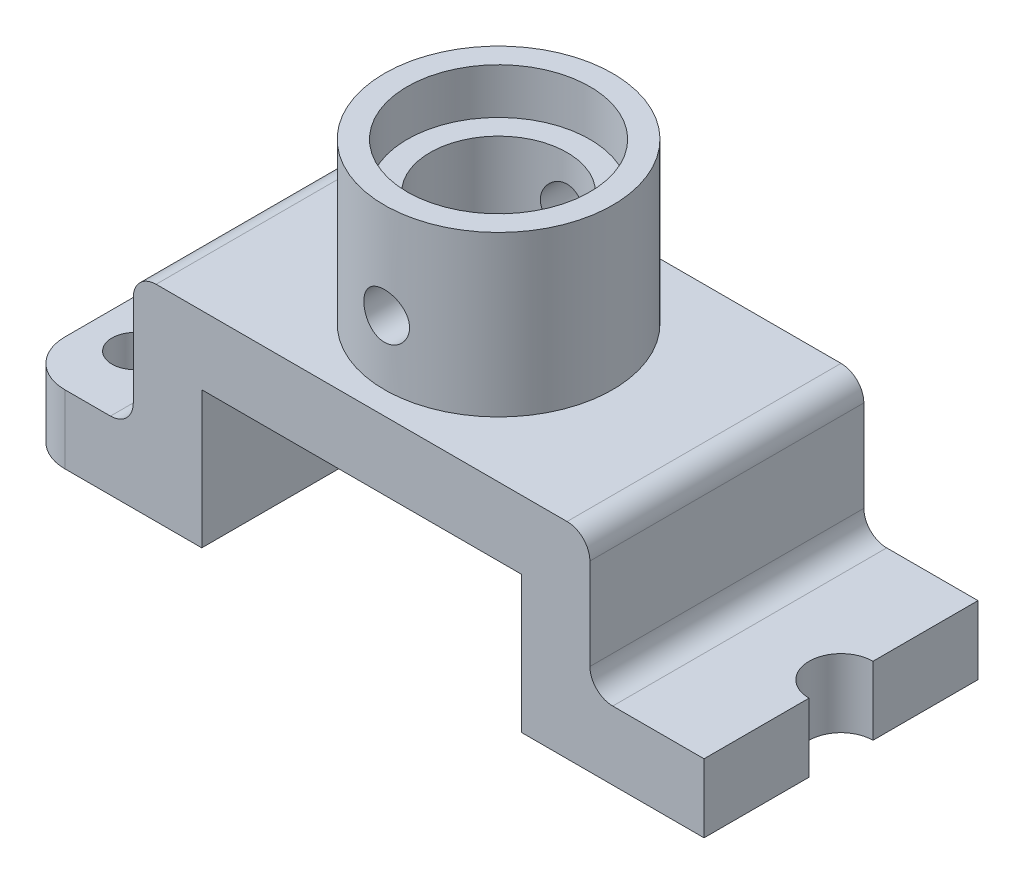
from build123d import *

# Parameters (mm, degrees)
SKETCH1_W           = 150
SKETCH1_H           = 45
BOSS_EXTRUDE1_DEPTH = 60
SKETCH2_W           = 70
SKETCH2_H           = 30
CUT_EXTRUDE1_DEPTH  = 60
SKETCH8_W           = 25
SKETCH8_H           = 60
CUT_EXTRUDE5_DEPTH  = 30
SKETCH9_R           = 25
BOSS_EXTRUDE4_DEPTH = 35
SKETCH10_R          = 20
SKETCH10_R_2        = 15
CUT_EXTRUDE7_DEPTH  = 10
SKETCH10_5_R        = 15
CUT_EXTRUDE8_DEPTH  = 70
SKETCH12_R          = 5
CUT_EXTRUDE9_DEPTH  = 70
FILLET1_R           = 10
SKETCH13_R          = 7
CUT_EXTRUDE10_DEPTH = 15
SKETCH14_R          = 5
CUT_EXTRUDE11_DEPTH = 15
FILLET2_R           = 5


with BuildPart() as part:
    # Sketch1 → Boss-Extrude1 (new body)
    with BuildSketch(Plane.XY):
        Rectangle(SKETCH1_W, SKETCH1_H)
    extrude(amount=BOSS_EXTRUDE1_DEPTH)

    # Sketch2 → Cut-Extrude1 (cut)
    with BuildSketch(Plane.XY.offset(60)):
        with Locations((0, -7.5)):
            Rectangle(SKETCH2_W, SKETCH2_H)
    extrude(amount=-CUT_EXTRUDE1_DEPTH, mode=Mode.SUBTRACT)

    # Sketch8 → Cut-Extrude5 (cut)
    with BuildSketch(Plane(origin=(0, 22.5, 0), x_dir=(1, 0, 0), z_dir=(0, 1, 0))):
        with Locations((-62.5, -30)):
            Rectangle(SKETCH8_W, SKETCH8_H)
        with Locations((62.5, -30)):
            Rectangle(SKETCH8_W, SKETCH8_H)
    extrude(amount=-CUT_EXTRUDE5_DEPTH, mode=Mode.SUBTRACT)

    # Sketch9 → Boss-Extrude4 (add)
    with BuildSketch(Plane(origin=(0, 22.5, 0), x_dir=(1, 0, 0), z_dir=(0, 1, 0))):
        with Locations((0, -30)):
            Circle(SKETCH9_R)
    extrude(amount=BOSS_EXTRUDE4_DEPTH)

    # Sketch10 → Cut-Extrude7 (cut)
    with BuildSketch(Plane(origin=(0, 57.5, 0), x_dir=(1, 0, 0), z_dir=(0, 1, 0))):
        with Locations((0, -30)):
            Circle(SKETCH10_R)
        with Locations((0, -30)):
            Circle(SKETCH10_R_2, mode=Mode.SUBTRACT)
    extrude(amount=-CUT_EXTRUDE7_DEPTH, mode=Mode.SUBTRACT)

    # Sketch10<5> → Cut-Extrude8 (cut)
    with BuildSketch(Plane(origin=(0, 57.5, 0), x_dir=(1, 0, 0), z_dir=(0, 1, 0))):
        with Locations((0, -30)):
            Circle(SKETCH10_5_R)
    extrude(amount=-CUT_EXTRUDE8_DEPTH, mode=Mode.SUBTRACT)

    # Sketch12 → Cut-Extrude9 (cut)
    with BuildSketch(Plane.XY.offset(60)):
        with Locations((0, 36.5)):
            Circle(SKETCH12_R)
    extrude(amount=-CUT_EXTRUDE9_DEPTH, mode=Mode.SUBTRACT)

    # Fillet1
    fillet1_edges = [part.edges().sort_by_distance(p)[0] for p in [
        (-75, -15, 60),
        (-75, -15, 0),
    ]]
    fillet(fillet1_edges, radius=FILLET1_R)

    # Sketch13 → Cut-Extrude10 (cut)
    with BuildSketch(Plane(origin=(0, -7.5, 0), x_dir=(1, 0, 0), z_dir=(0, 1, 0))):
        with Locations((75, -30)):
            Circle(SKETCH13_R)
    extrude(amount=-CUT_EXTRUDE10_DEPTH, mode=Mode.SUBTRACT)

    # Sketch14 → Cut-Extrude11 (cut)
    with BuildSketch(Plane(origin=(0, -7.5, 0), x_dir=(1, 0, 0), z_dir=(0, 1, 0))):
        with Locations((-64.657240853, -15)):
            Circle(SKETCH14_R)
        with Locations((-64.657240853, -45)):
            Circle(SKETCH14_R)
    extrude(amount=-CUT_EXTRUDE11_DEPTH, mode=Mode.SUBTRACT)

    # Fillet2
    fillet2_edges = [part.edges().sort_by_distance(p)[0] for p in [
        (-50, -7.5, 30),
        (50, -7.5, 30),
        (50, 22.5, 30),
        (-50, 22.5, 30),
    ]]
    fillet(fillet2_edges, radius=FILLET2_R)


solid = part.part
